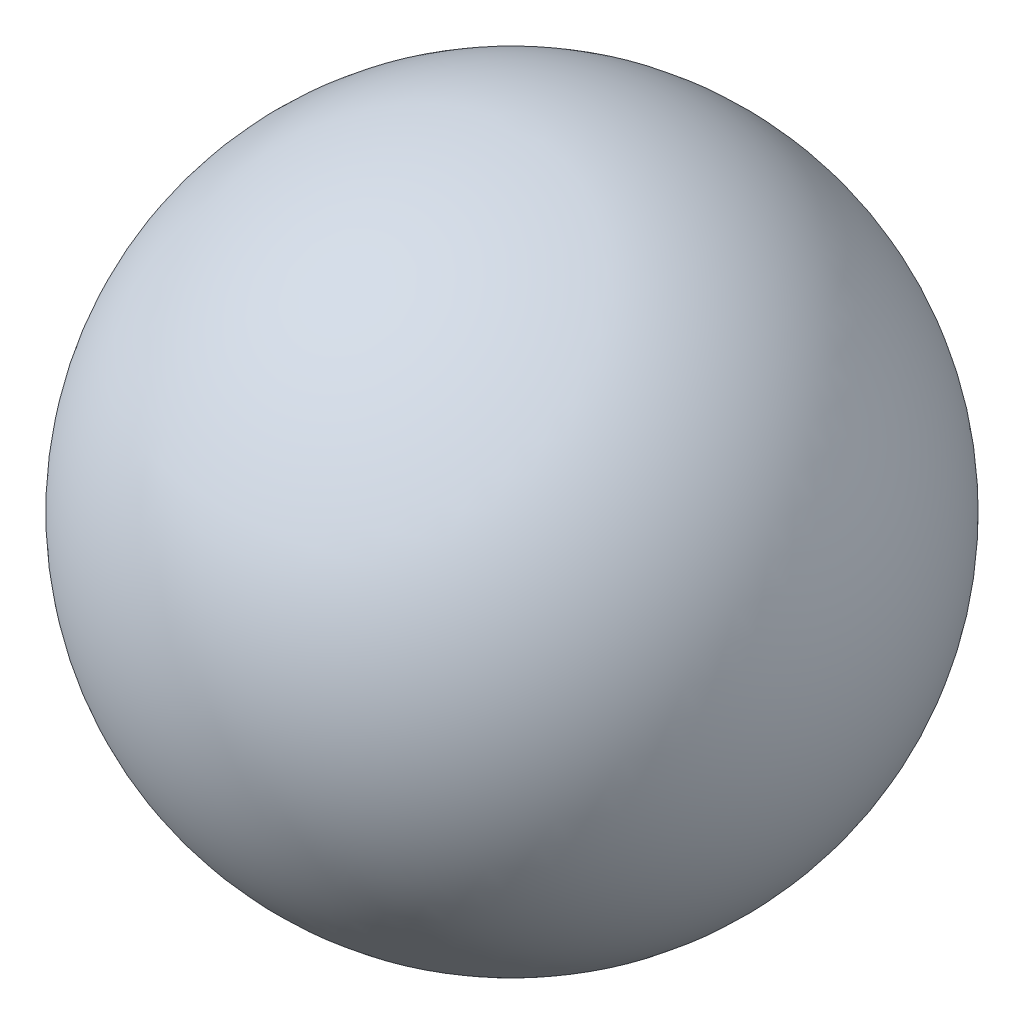
from build123d import *


with BuildPart() as part:
    # Schizzo1 → Rivoluzione1 (revolve)
    with BuildSketch(Plane.XY):
        with BuildLine():
            Line((0, 0), (0, 120))
            ThreePointArc((0, 120), (-60, 60), (0, 0))
        make_face()
    revolve(axis=Axis((0, 0, 0), (0, 1, 0)))


solid = part.part
